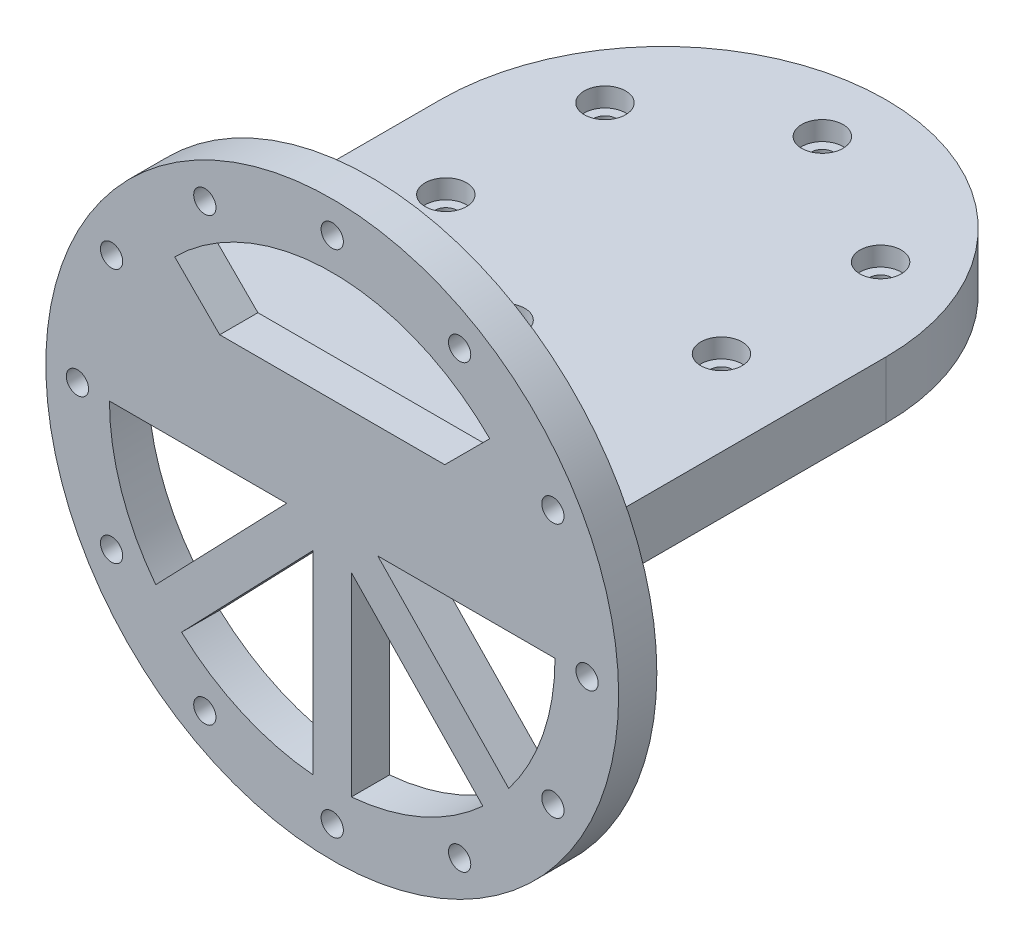
from build123d import *

# Parameters (mm, degrees)
SKETCH1_R            = 35
BOSS_EXTRUDE1_DEPTH  = 9
SKETCH2_R            = 30
CUT_EXTRUDE1_DEPTH   = 3
SKETCH3_R            = 1.75
CUT_EXTRUDE2_DEPTH   = 51.309044912
SKETCH4_R            = 3.25
CUT_EXTRUDE3_DEPTH   = 3
BOSS_EXTRUDE3_START  = -9
BOSS_EXTRUDE3_DEPTH  = 9
SKETCH21_W           = 70
SKETCH21_H           = 6
BOSS_EXTRUDE8_DEPTH  = 6
SKETCH26_R           = 45
BOSS_EXTRUDE12_DEPTH = 6
CUT_EXTRUDE20_REACH  = 112.431
SKETCH27_R           = 1.75
SKETCH28_R           = 3.25
CUT_EXTRUDE21_DEPTH  = 3
CUT_EXTRUDE23_DEPTH  = 106.768615383


with BuildPart() as part:
    # Sketch1 → Boss-Extrude1 (new body)
    with BuildSketch(Plane(origin=(0, 0, 0), x_dir=(1, 0, 0), z_dir=(0, 1, 0))):
        with Locations(Location((0, 0, 0), (0, 0, 270))):
            Circle(SKETCH1_R)
    extrude(amount=BOSS_EXTRUDE1_DEPTH)

    # Sketch2 → Cut-Extrude1 (cut)
    with BuildSketch(Plane.XZ):
        with Locations(Location((0, 0, 0), (0, 0, 270))):
            Circle(SKETCH2_R)
    extrude(amount=-CUT_EXTRUDE1_DEPTH, mode=Mode.SUBTRACT)

    # Sketch3 → Cut-Extrude2 (cut, through all)
    with BuildSketch(Plane(origin=(0, 9, 0), x_dir=(1, 0, 0), z_dir=(0, 1, 0))):
        with Locations(Location((0, -25, 0), (0, 0, 270))):
            Circle(SKETCH3_R)
        with Locations(Location((-21.650635095, -12.5, 0), (0, 0, 270))):
            Circle(SKETCH3_R)
        with Locations(Location((-21.650635095, 12.5, 0), (0, 0, 270))):
            Circle(SKETCH3_R)
        with Locations(Location((0, 25, 0), (0, 0, 270))):
            Circle(SKETCH3_R)
        with Locations(Location((21.650635095, 12.5, 0), (0, 0, 270))):
            Circle(SKETCH3_R)
        with Locations(Location((21.650635095, -12.5, 0), (0, 0, 270))):
            Circle(SKETCH3_R)
    extrude(amount=-CUT_EXTRUDE2_DEPTH, mode=Mode.SUBTRACT)

    # Sketch4 → Cut-Extrude3 (cut)
    with BuildSketch(Plane(origin=(0, 9, 0), x_dir=(1, 0, 0), z_dir=(0, 1, 0))):
        with Locations(Location((0, 25, 0), (0, 0, 270))):
            Circle(SKETCH4_R)
        with Locations(Location((21.650635095, 12.5, 0), (0, 0, 270))):
            Circle(SKETCH4_R)
        with Locations(Location((21.650635095, -12.5, 0), (0, 0, 270))):
            Circle(SKETCH4_R)
        with Locations(Location((0, -25, 0), (0, 0, 270))):
            Circle(SKETCH4_R)
        with Locations(Location((-21.650635095, -12.5, 0), (0, 0, 270))):
            Circle(SKETCH4_R)
        with Locations(Location((-21.650635095, 12.5, 0), (0, 0, 270))):
            Circle(SKETCH4_R)
    extrude(amount=-CUT_EXTRUDE3_DEPTH, mode=Mode.SUBTRACT)

    # Sketch5 → Boss-Extrude3 (add)
    with BuildSketch(Plane(origin=(0, 9, 0), x_dir=(1, 0, 0), z_dir=(0, 1, 0)).offset(BOSS_EXTRUDE3_START)):
        with BuildLine():
            ThreePointArc((35, 0), (0, -35), (-35, 0))
            Line((-35, 0), (-35, -52))
            Line((-35, -52), (35, -52))
            Line((35, -52), (35, 0))
        make_face()
    extrude(amount=BOSS_EXTRUDE3_DEPTH)

    # Sketch21 → Boss-Extrude8 (add)
    with BuildSketch(Plane.XZ):
        with Locations((0, 49)):
            Rectangle(SKETCH21_W, SKETCH21_H)
    extrude(amount=BOSS_EXTRUDE8_DEPTH)

    # Sketch26 → Boss-Extrude12 (add)
    with BuildSketch(Plane.XY.offset(52)):
        with Locations((0, -6)):
            Circle(SKETCH26_R)
    extrude(amount=-BOSS_EXTRUDE12_DEPTH)

    # Sketch27 → Cut-Extrude20 (cut, up to next)
    with BuildSketch(Plane.XY.offset(52), mode=Mode.PRIVATE) as cut_extrude20_sk1:
        with Locations((0, -46.031695342)):
            Circle(SKETCH27_R)
    cut_extrude20_tool1 = extrude(cut_extrude20_sk1.sketch, amount=-CUT_EXTRUDE20_REACH, mode=Mode.PRIVATE) & part.part
    # Sketch27 → Cut-Extrude20 (cut, up to next)
    with BuildSketch(Plane.XY.offset(52), mode=Mode.PRIVATE) as cut_extrude20_sk2:
        with Locations((-20.015847671, -40.668465123)):
            Circle(SKETCH27_R)
    cut_extrude20_tool2 = extrude(cut_extrude20_sk2.sketch, amount=-CUT_EXTRUDE20_REACH, mode=Mode.PRIVATE) & part.part
    # Sketch27 → Cut-Extrude20 (cut, up to next)
    with BuildSketch(Plane.XY.offset(52), mode=Mode.PRIVATE) as cut_extrude20_sk3:
        with Locations((-34.668465123, -26.015847671)):
            Circle(SKETCH27_R)
    cut_extrude20_tool3 = extrude(cut_extrude20_sk3.sketch, amount=-CUT_EXTRUDE20_REACH, mode=Mode.PRIVATE) & part.part
    # Sketch27 → Cut-Extrude20 (cut, up to next)
    with BuildSketch(Plane.XY.offset(52), mode=Mode.PRIVATE) as cut_extrude20_sk4:
        with Locations((-40.031695342, -6)):
            Circle(SKETCH27_R)
    cut_extrude20_tool4 = extrude(cut_extrude20_sk4.sketch, amount=-CUT_EXTRUDE20_REACH, mode=Mode.PRIVATE) & part.part
    # Sketch27 → Cut-Extrude20 (cut, up to next)
    with BuildSketch(Plane.XY.offset(52), mode=Mode.PRIVATE) as cut_extrude20_sk5:
        with Locations((-34.668465123, 14.015847671)):
            Circle(SKETCH27_R)
    cut_extrude20_tool5 = extrude(cut_extrude20_sk5.sketch, amount=-CUT_EXTRUDE20_REACH, mode=Mode.PRIVATE) & part.part
    # Sketch27 → Cut-Extrude20 (cut, up to next)
    with BuildSketch(Plane.XY.offset(52), mode=Mode.PRIVATE) as cut_extrude20_sk6:
        with Locations((-20.015847671, 28.668465123)):
            Circle(SKETCH27_R)
    cut_extrude20_tool6 = extrude(cut_extrude20_sk6.sketch, amount=-CUT_EXTRUDE20_REACH, mode=Mode.PRIVATE) & part.part
    # Sketch27 → Cut-Extrude20 (cut, up to next)
    with BuildSketch(Plane.XY.offset(52), mode=Mode.PRIVATE) as cut_extrude20_sk7:
        with Locations((0, 34.031695342)):
            Circle(SKETCH27_R)
    cut_extrude20_tool7 = extrude(cut_extrude20_sk7.sketch, amount=-CUT_EXTRUDE20_REACH, mode=Mode.PRIVATE) & part.part
    # Sketch27 → Cut-Extrude20 (cut, up to next)
    with BuildSketch(Plane.XY.offset(52), mode=Mode.PRIVATE) as cut_extrude20_sk8:
        with Locations((20.015847671, 28.668465123)):
            Circle(SKETCH27_R)
    cut_extrude20_tool8 = extrude(cut_extrude20_sk8.sketch, amount=-CUT_EXTRUDE20_REACH, mode=Mode.PRIVATE) & part.part
    # Sketch27 → Cut-Extrude20 (cut, up to next)
    with BuildSketch(Plane.XY.offset(52), mode=Mode.PRIVATE) as cut_extrude20_sk9:
        with Locations((34.668465123, 14.015847671)):
            Circle(SKETCH27_R)
    cut_extrude20_tool9 = extrude(cut_extrude20_sk9.sketch, amount=-CUT_EXTRUDE20_REACH, mode=Mode.PRIVATE) & part.part
    # Sketch27 → Cut-Extrude20 (cut, up to next)
    with BuildSketch(Plane.XY.offset(52), mode=Mode.PRIVATE) as cut_extrude20_sk10:
        with Locations((40.031695342, -6)):
            Circle(SKETCH27_R)
    cut_extrude20_tool10 = extrude(cut_extrude20_sk10.sketch, amount=-CUT_EXTRUDE20_REACH, mode=Mode.PRIVATE) & part.part
    # Sketch27 → Cut-Extrude20 (cut, up to next)
    with BuildSketch(Plane.XY.offset(52), mode=Mode.PRIVATE) as cut_extrude20_sk11:
        with Locations((34.668465123, -26.015847671)):
            Circle(SKETCH27_R)
    cut_extrude20_tool11 = extrude(cut_extrude20_sk11.sketch, amount=-CUT_EXTRUDE20_REACH, mode=Mode.PRIVATE) & part.part
    # Sketch27 → Cut-Extrude20 (cut, up to next)
    with BuildSketch(Plane.XY.offset(52), mode=Mode.PRIVATE) as cut_extrude20_sk12:
        with Locations((20.015847671, -40.668465123)):
            Circle(SKETCH27_R)
    cut_extrude20_tool12 = extrude(cut_extrude20_sk12.sketch, amount=-CUT_EXTRUDE20_REACH, mode=Mode.PRIVATE) & part.part
    add(cut_extrude20_tool1.solids().sort_by_distance((0, -46.031695, 52))[0], mode=Mode.SUBTRACT)
    add(cut_extrude20_tool2.solids().sort_by_distance((-20.015848, -40.668465, 52))[0], mode=Mode.SUBTRACT)
    add(cut_extrude20_tool3.solids().sort_by_distance((-34.668465, -26.015848, 52))[0], mode=Mode.SUBTRACT)
    add(cut_extrude20_tool4.solids().sort_by_distance((-40.031695, -6, 52))[0], mode=Mode.SUBTRACT)
    add(cut_extrude20_tool5.solids().sort_by_distance((-34.668465, 14.015848, 52))[0], mode=Mode.SUBTRACT)
    add(cut_extrude20_tool6.solids().sort_by_distance((-20.015848, 28.668465, 52))[0], mode=Mode.SUBTRACT)
    add(cut_extrude20_tool7.solids().sort_by_distance((0, 34.031695, 52))[0], mode=Mode.SUBTRACT)
    add(cut_extrude20_tool8.solids().sort_by_distance((20.015848, 28.668465, 52))[0], mode=Mode.SUBTRACT)
    add(cut_extrude20_tool9.solids().sort_by_distance((34.668465, 14.015848, 52))[0], mode=Mode.SUBTRACT)
    add(cut_extrude20_tool10.solids().sort_by_distance((40.031695, -6, 52))[0], mode=Mode.SUBTRACT)
    add(cut_extrude20_tool11.solids().sort_by_distance((34.668465, -26.015848, 52))[0], mode=Mode.SUBTRACT)
    add(cut_extrude20_tool12.solids().sort_by_distance((20.015848, -40.668465, 52))[0], mode=Mode.SUBTRACT)

    # Sketch28 → Cut-Extrude21 (cut)
    with BuildSketch(Plane(origin=(0, 0, 46), x_dir=(-1, 0, 0), z_dir=(0, 0, -1))):
        with Locations((0, -46.031695342)):
            Circle(SKETCH28_R)
        with Locations((-20, -40.672711494)):
            Circle(SKETCH28_R)
        with Locations((-34.641016151, -26.031695342)):
            Circle(SKETCH28_R)
        with Locations((-40, -6.031695342)):
            Circle(SKETCH28_R)
        with Locations((-34.641016151, 13.968304658)):
            Circle(SKETCH28_R)
        with Locations((-20, 28.609320809)):
            Circle(SKETCH28_R)
        with Locations((0, 33.968304658)):
            Circle(SKETCH28_R)
        with Locations((20, 28.609320809)):
            Circle(SKETCH28_R)
        with Locations((34.641016151, 13.968304658)):
            Circle(SKETCH28_R)
        with Locations((40, -6.031695342)):
            Circle(SKETCH28_R)
        with Locations((34.641016151, -26.031695342)):
            Circle(SKETCH28_R)
        with Locations((20, -40.672711494)):
            Circle(SKETCH28_R)
    extrude(amount=-CUT_EXTRUDE21_DEPTH, mode=Mode.SUBTRACT)

    # Sketch30 → Cut-Extrude23 (cut, through all)
    with BuildSketch(Plane(origin=(0, 0, 46), x_dir=(-1, 0, 0), z_dir=(0, 0, -1))):
        with BuildLine():
            Line((-3, -10.325026058), (-3, -40.871191548))
            ThreePointArc((-3, -40.871191548), (-14.085565968, -38.040549798), (-23.665962091, -31.786086138))
            Line((-23.665962091, -31.786086138), (-3, -10.325026058))
        make_face()
        with BuildLine():
            Line((3, -10.325026058), (3, -40.871191548))
            ThreePointArc((3, -40.871191548), (14.085565968, -38.040549798), (23.665962091, -31.786086138))
            Line((23.665962091, -31.786086138), (3, -10.325026058))
        make_face()
        with BuildLine():
            Line((-7.164790753, -6), (-35, -6))
            ThreePointArc((-35, -6), (-33.132555391, -17.279794913), (-27.729498669, -27.355910272))
            Line((-27.729498669, -27.355910272), (-7.164790753, -6))
        make_face()
        with BuildLine():
            Line((7.164790753, -6), (35, -6))
            ThreePointArc((35, -6), (33.132555391, -17.279794913), (27.729498669, -27.355910272))
            Line((27.729498669, -27.355910272), (7.164790753, -6))
        make_face()
        with BuildLine():
            Line((-24.748737342, 18.748737342), (-17.67766953, 11.67766953))
            Line((-17.67766953, 11.67766953), (17.67766953, 11.67766953))
            Line((17.67766953, 11.67766953), (24.748737342, 18.748737342))
            ThreePointArc((24.748737342, 18.748737342), (0, 29), (-24.748737342, 18.748737342))
        make_face()
    extrude(amount=-CUT_EXTRUDE23_DEPTH, mode=Mode.SUBTRACT)


solid = part.part
